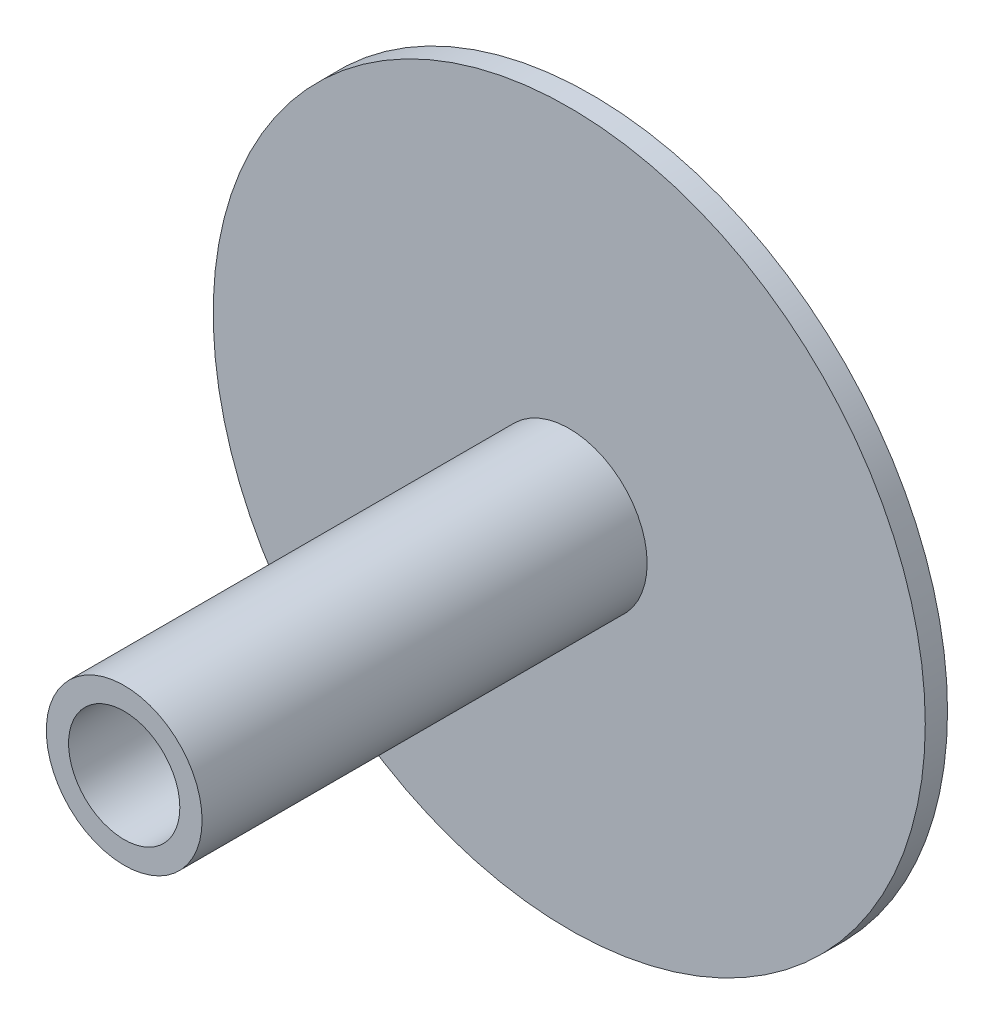
from build123d import *

# Parameters (mm, degrees)
SKETCH1_R               = 16
BOSS_EXTRUDE1_DEPTH     = 1
SKETCH2_R               = 3.5
BOSS_EXTRUDE2_DEPTH     = 20
CUT_EXTRUDE1_DEPTH      = 31.870698081
CUT_EXTRUDE1_DEPTH_BACK = 31.870698081
SKETCH3_R               = 2.5


with BuildPart() as part:
    # Sketch1 → Boss-Extrude1 (new body)
    with BuildSketch(Plane.XY):
        Circle(SKETCH1_R)
    extrude(amount=BOSS_EXTRUDE1_DEPTH)

    # Sketch2 → Boss-Extrude2 (add)
    with BuildSketch(Plane.XY.offset(1)):
        Circle(SKETCH2_R)
    extrude(amount=BOSS_EXTRUDE2_DEPTH)

    # Sketch3 → Cut-Extrude1 (cut, two sides: drawn at the far end of the back side and taken through both)
    with BuildSketch(Plane.XY.offset(21).offset(-CUT_EXTRUDE1_DEPTH_BACK)):
        Circle(SKETCH3_R)
    extrude(amount=CUT_EXTRUDE1_DEPTH + CUT_EXTRUDE1_DEPTH_BACK, mode=Mode.SUBTRACT)


solid = part.part
